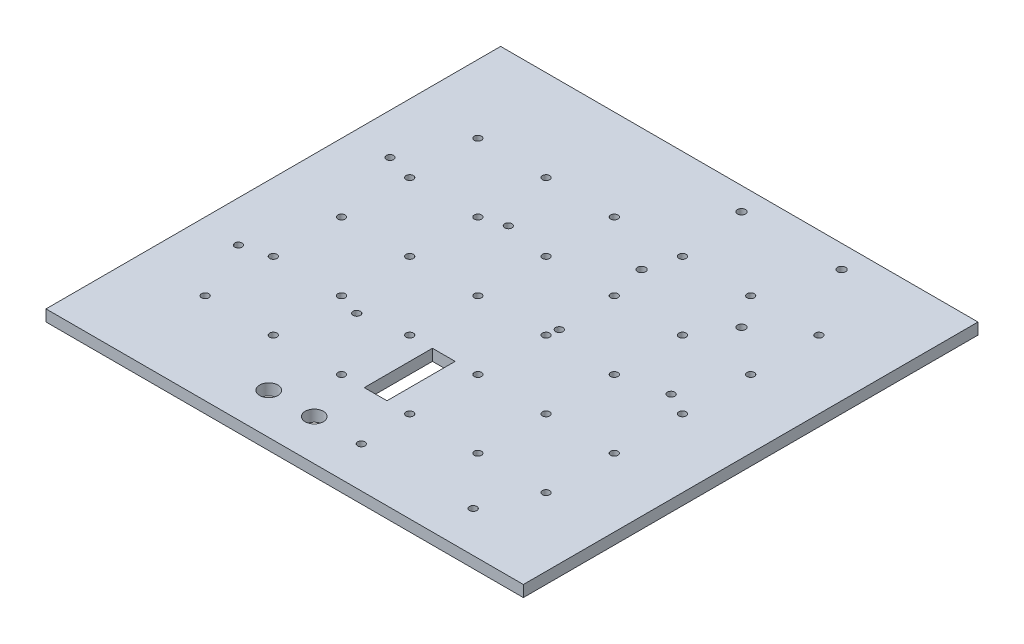
from build123d import *

# Parameters (mm, degrees)
SKETCH_1_W          = 210
SKETCH_1_H          = 200
SKETCH_1_R          = 1.6
EXTRUDE_1_DEPTH     = 5
SKETCH_3_R          = 1.6
CUT_EXTRUDE_1_DEPTH = 5
SKETCH_4_R          = 1.6
SKETCH_4_R_2        = 4
CUT_EXTRUDE_2_DEPTH = 5
SKETCH_5_R          = 1.6
CUT_EXTRUDE_3_DEPTH = 147.095579079
SKETCH_6_W          = 10
SKETCH_6_H          = 30
CUT_EXTRUDE_4_DEPTH = 147.095579079
CUT_EXTRUDE_5_DEPTH = 147.095579079


with BuildPart() as part:
    # 草图1 → 凸台-拉伸1 (new body)
    with BuildSketch(Plane(origin=(0, 0, 0), x_dir=(1, 0, 0), z_dir=(0, 1, 0))):
        with Locations((0.714384236, -0.714384236)):
            Rectangle(SKETCH_1_W, SKETCH_1_H)
        with Locations(Location((-74.285615764, -60.714384236, 0), (0, 0, 270))):
            Circle(SKETCH_1_R, mode=Mode.SUBTRACT)
        with Locations(Location((75.714384236, 59.285615764, 0), (0, 0, 270))):
            Circle(SKETCH_1_R, mode=Mode.SUBTRACT)
        with Locations(Location((-74.285615764, 29.285615764, 0), (0, 0, 270))):
            Circle(SKETCH_1_R, mode=Mode.SUBTRACT)
        with Locations(Location((-74.285615764, -0.714384236, 0), (0, 0, 270))):
            Circle(SKETCH_1_R, mode=Mode.SUBTRACT)
        with Locations(Location((-74.285615764, -30.714384236, 0), (0, 0, 270))):
            Circle(SKETCH_1_R, mode=Mode.SUBTRACT)
        with Locations(Location((-44.285615764, -60.714384236, 0), (0, 0, 270))):
            Circle(SKETCH_1_R, mode=Mode.SUBTRACT)
        with Locations(Location((-44.285615764, 59.285615764, 0), (0, 0, 270))):
            Circle(SKETCH_1_R, mode=Mode.SUBTRACT)
        with Locations(Location((75.714384236, -30.714384236, 0), (0, 0, 270))):
            Circle(SKETCH_1_R, mode=Mode.SUBTRACT)
        with Locations(Location((75.714384236, -0.714384236, 0), (0, 0, 270))):
            Circle(SKETCH_1_R, mode=Mode.SUBTRACT)
        with Locations(Location((75.714384236, 29.285615764, 0), (0, 0, 270))):
            Circle(SKETCH_1_R, mode=Mode.SUBTRACT)
        with Locations(Location((75.714384236, -60.714384236, 0), (0, 0, 270))):
            Circle(SKETCH_1_R, mode=Mode.SUBTRACT)
        with Locations(Location((-74.285615764, 59.285615764, 0), (0, 0, 270))):
            Circle(SKETCH_1_R, mode=Mode.SUBTRACT)
        with Locations(Location((-44.285615764, 29.285615764, 0), (0, 0, 270))):
            Circle(SKETCH_1_R, mode=Mode.SUBTRACT)
        with Locations(Location((-44.285615764, -0.714384236, 0), (0, 0, 270))):
            Circle(SKETCH_1_R, mode=Mode.SUBTRACT)
        with Locations(Location((-44.285615764, -30.714384236, 0), (0, 0, 270))):
            Circle(SKETCH_1_R, mode=Mode.SUBTRACT)
        with Locations(Location((-14.285615764, 59.285615764, 0), (0, 0, 270))):
            Circle(SKETCH_1_R, mode=Mode.SUBTRACT)
        with Locations(Location((-14.285615764, -60.714384236, 0), (0, 0, 270))):
            Circle(SKETCH_1_R, mode=Mode.SUBTRACT)
        with Locations(Location((15.714384236, 59.285615764, 0), (0, 0, 270))):
            Circle(SKETCH_1_R, mode=Mode.SUBTRACT)
        with Locations(Location((15.714384236, -60.714384236, 0), (0, 0, 270))):
            Circle(SKETCH_1_R, mode=Mode.SUBTRACT)
        with Locations(Location((45.714384236, 59.285615764, 0), (0, 0, 270))):
            Circle(SKETCH_1_R, mode=Mode.SUBTRACT)
        with Locations(Location((45.714384236, 29.285615764, 0), (0, 0, 270))):
            Circle(SKETCH_1_R, mode=Mode.SUBTRACT)
        with Locations(Location((45.714384236, -0.714384236, 0), (0, 0, 270))):
            Circle(SKETCH_1_R, mode=Mode.SUBTRACT)
        with Locations(Location((45.714384236, -30.714384236, 0), (0, 0, 270))):
            Circle(SKETCH_1_R, mode=Mode.SUBTRACT)
        with Locations(Location((45.714384236, -60.714384236, 0), (0, 0, 270))):
            Circle(SKETCH_1_R, mode=Mode.SUBTRACT)
    extrude(amount=EXTRUDE_1_DEPTH)

    # 草图3 → 切除-拉伸1 (cut)
    with BuildSketch(Plane(origin=(0, 5, 0), x_dir=(1, 0, 0), z_dir=(0, 1, 0))):
        with Locations(Location((-86.285615764, -34.064384236, 0), (0, 0, 270))):
            Circle(SKETCH_3_R)
        with Locations(Location((-34.235615764, 32.635615764, 0), (0, 0, 270))):
            Circle(SKETCH_3_R)
        with Locations(Location((-34.235615764, -34.064384236, 0), (0, 0, 270))):
            Circle(SKETCH_3_R)
        with Locations(Location((-86.285615764, 32.635615764, 0), (0, 0, 270))):
            Circle(SKETCH_3_R)
        with Locations(Location((16.504384236, -82.794384236, 0), (0, 0, 270))):
            Circle(SKETCH_3_R)
        with Locations(Location((65.714384236, 4.285615764, 0), (0, 0, 270))):
            Circle(SKETCH_3_R)
        with Locations(Location((65.714384236, -82.794384236, 0), (0, 0, 270))):
            Circle(SKETCH_3_R)
        with Locations(Location((16.504384236, 4.285615764, 0), (0, 0, 270))):
            Circle(SKETCH_3_R)
    extrude(amount=-CUT_EXTRUDE_1_DEPTH, mode=Mode.SUBTRACT)

    # 草图4 → 切除-拉伸2 (cut)
    with BuildSketch(Plane(origin=(0, 5, 0), x_dir=(1, 0, 0), z_dir=(0, 1, 0))):
        with Locations(Location((65.714384236, -82.794384236, 0), (0, 0, 270))):
            Circle(SKETCH_4_R)
        with Locations(Location((-4.285615764, -82.714384236, 0), (0, 0, 270))):
            Circle(SKETCH_4_R_2)
        with Locations(Location((-24.285615764, -82.714384236, 0), (0, 0, 270))):
            Circle(SKETCH_4_R_2)
    extrude(amount=-CUT_EXTRUDE_2_DEPTH, mode=Mode.SUBTRACT)

    # 草图5 → 切除-拉伸3 (cut, through all)
    with BuildSketch(Plane(origin=(0, 5, 0), x_dir=(1, 0, 0), z_dir=(0, 1, 0))):
        with Locations(Location((-14.285615764, 59.285615764, 0), (0, 0, 270))):
            Circle(SKETCH_5_R)
        with Locations(Location((15.714384236, 59.285615764, 0), (0, 0, 270))):
            Circle(SKETCH_5_R)
        with Locations(Location((-14.285615764, 29.285615764, 0), (0, 0, 270))):
            Circle(SKETCH_5_R)
        with Locations(Location((15.714384236, 29.285615764, 0), (0, 0, 270))):
            Circle(SKETCH_5_R)
        with Locations(Location((-14.285615764, -0.714384236, 0), (0, 0, 270))):
            Circle(SKETCH_5_R)
        with Locations(Location((15.714384236, -0.714384236, 0), (0, 0, 270))):
            Circle(SKETCH_5_R)
        with Locations(Location((-14.285615764, -30.714384236, 0), (0, 0, 270))):
            Circle(SKETCH_5_R)
        with Locations(Location((15.714384236, -30.714384236, 0), (0, 0, 270))):
            Circle(SKETCH_5_R)
    extrude(amount=-CUT_EXTRUDE_3_DEPTH, mode=Mode.SUBTRACT)

    # 草图6 → 切除-拉伸4 (cut, through all)
    with BuildSketch(Plane(origin=(0, 5, 0), x_dir=(1, 0, 0), z_dir=(0, 1, 0))):
        with Locations((0.714384236, -45.714384236)):
            Rectangle(SKETCH_6_W, SKETCH_6_H)
    extrude(amount=-CUT_EXTRUDE_4_DEPTH, mode=Mode.SUBTRACT)

    # 草图7 → 切除-拉伸5 (cut, through all)
    with BuildSketch(Plane(origin=(0, 5, 0), x_dir=(1, 0, 0), z_dir=(0, 1, 0))):
        with BuildLine():
            Line((11.714384236, 87.535615764), (11.714384236, 89.285615764))
            Line((11.714384236, 89.285615764), (13.464384236, 89.285615764))
            ThreePointArc((13.464384236, 89.285615764), (10.476947369, 90.523052631), (11.714384236, 87.535615764))
        make_face()
        with BuildLine():
            Line((13.464384236, 89.285615764), (11.714384236, 89.285615764))
            Line((11.714384236, 89.285615764), (11.714384236, 87.535615764))
            ThreePointArc((11.714384236, 87.535615764), (12.951821103, 88.048178897), (13.464384236, 89.285615764))
        make_face()
        with BuildLine():
            ThreePointArc((13.464384236, 45.285615764), (12.951821103, 46.523052631), (11.714384236, 47.035615764))
            Line((11.714384236, 47.035615764), (11.714384236, 45.285615764))
            Line((11.714384236, 45.285615764), (13.464384236, 45.285615764))
        make_face()
        with BuildLine():
            Line((11.714384236, 45.285615764), (11.714384236, 47.035615764))
            ThreePointArc((11.714384236, 47.035615764), (10.476947369, 44.048178897), (13.464384236, 45.285615764))
            Line((13.464384236, 45.285615764), (11.714384236, 45.285615764))
        make_face()
        with BuildLine():
            ThreePointArc((57.464384236, 45.285615764), (56.951821103, 46.523052631), (55.714384236, 47.035615764))
            Line((55.714384236, 47.035615764), (55.714384236, 45.285615764))
            Line((55.714384236, 45.285615764), (53.964384236, 45.285615764))
            ThreePointArc((53.964384236, 45.285615764), (55.714384236, 43.535615764), (57.464384236, 45.285615764))
        make_face()
        with BuildLine():
            Line((55.714384236, 45.285615764), (55.714384236, 47.035615764))
            ThreePointArc((55.714384236, 47.035615764), (54.476947369, 46.523052631), (53.964384236, 45.285615764))
            Line((53.964384236, 45.285615764), (55.714384236, 45.285615764))
        make_face()
        with BuildLine():
            ThreePointArc((57.464384236, 89.285615764), (55.714384236, 91.035615764), (53.964384236, 89.285615764))
            Line((53.964384236, 89.285615764), (55.714384236, 89.285615764))
            Line((55.714384236, 89.285615764), (55.714384236, 87.535615764))
            ThreePointArc((55.714384236, 87.535615764), (56.951821103, 88.048178897), (57.464384236, 89.285615764))
        make_face()
        with BuildLine():
            Line((55.714384236, 89.285615764), (53.964384236, 89.285615764))
            ThreePointArc((53.964384236, 89.285615764), (54.476947369, 88.048178897), (55.714384236, 87.535615764))
            Line((55.714384236, 87.535615764), (55.714384236, 89.285615764))
        make_face()
    extrude(amount=-CUT_EXTRUDE_5_DEPTH, mode=Mode.SUBTRACT)


solid = part.part
